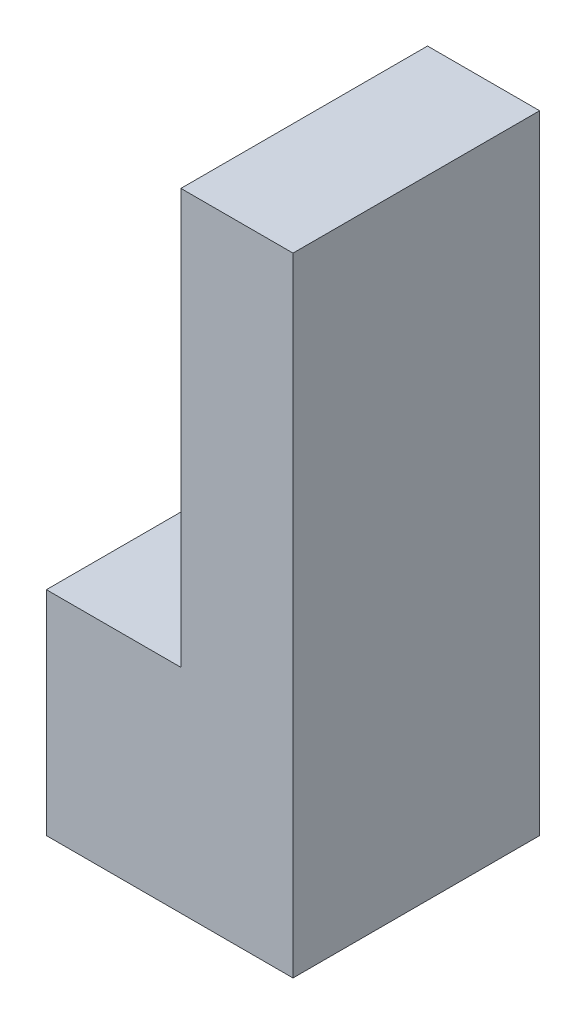
from build123d import *

# Parameters (mm, degrees)
SKETCH1_W           = 139.7
SKETCH1_H           = 139.7
BOSS_EXTRUDE1_DEPTH = 355.6
SKETCH3_W           = 76.2
SKETCH3_H           = 139.7
CUT_EXTRUDE1_DEPTH  = 234.95


with BuildPart() as part:
    # Sketch1 → Boss-Extrude1 (new body)
    with BuildSketch(Plane(origin=(0, 0, 0), x_dir=(1, 0, 0), z_dir=(0, 1, 0))):
        with Locations((-302.107289173, 364.772222222)):
            Rectangle(SKETCH1_W, SKETCH1_H)
    extrude(amount=BOSS_EXTRUDE1_DEPTH)

    # Sketch3 → Cut-Extrude1 (cut)
    with BuildSketch(Plane(origin=(0, 355.6, 0), x_dir=(1, 0, 0), z_dir=(0, 1, 0))):
        with Locations((-333.857289173, 364.772222222)):
            Rectangle(SKETCH3_W, SKETCH3_H)
    extrude(amount=-CUT_EXTRUDE1_DEPTH, mode=Mode.SUBTRACT)


solid = part.part
